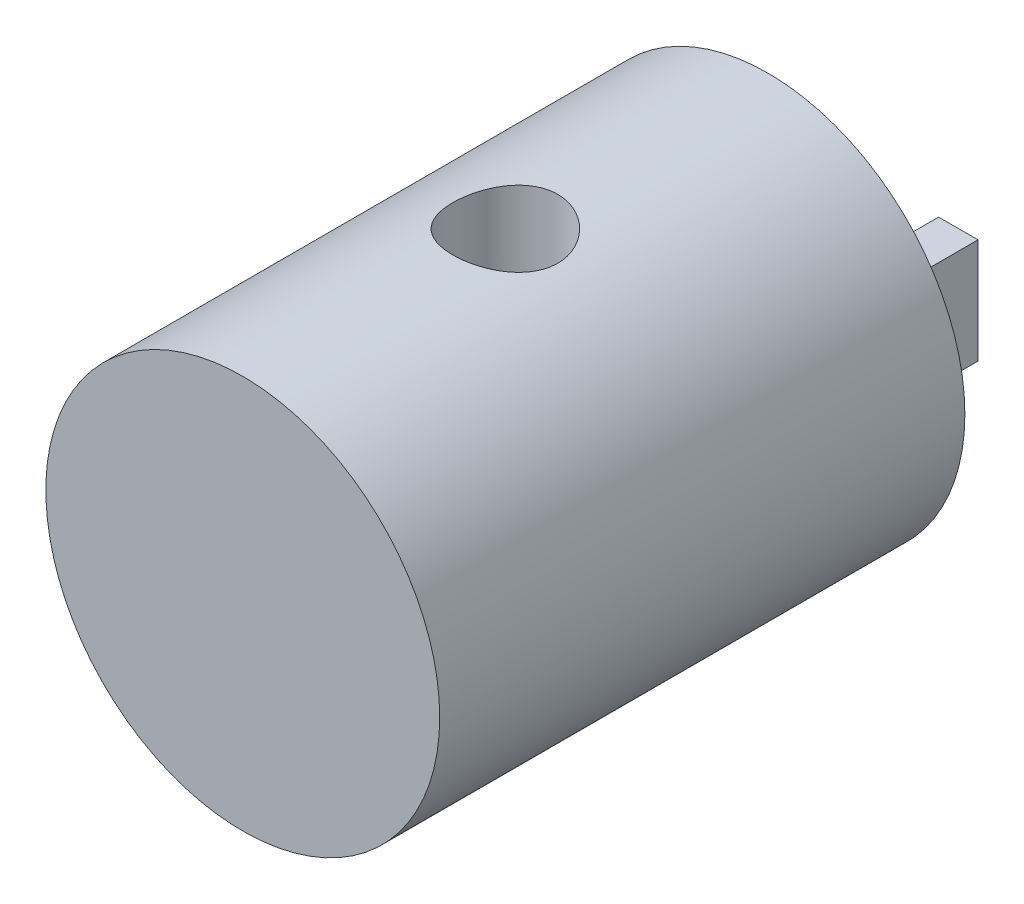
from build123d import *

# Parameters (mm, degrees)
CROQUIS1_R                             = 7.5
SALIENTE_EXTRUIR1_DEPTH                = 20
CROQUIS2_W                             = 5
CROQUIS2_H                             = 4
SALIENTE_EXTRUIR2_DEPTH                = 4
CROQUIS4_W                             = 8
CROQUIS4_H                             = 4
SALIENTE_EXTRUIR4_DEPTH                = 4
CORTAR_EXTRUIR1_REACH                  = 28.879
CROQUIS6_W                             = 5
CROQUIS6_H                             = 4
CROQUIS6_W_2                           = 2.5
CROQUIS7_R                             = 1
CORTAR_EXTRUIR2_DEPTH                  = 5
CORTAR_EXTRUIR3_REACH                  = 28.879
CORTAR_EXTRUIR3_END_RADIUS             = 7.5
CROQUIS8_R                             = 2
CORTAR_EXTRUIR3_DIRECTION_2_REACH      = 28.879
CORTAR_EXTRUIR3_DIRECTION_2_END_RADIUS = 7.5
CROQUIS9_W                             = 4
CROQUIS9_H                             = 4
CORTAR_EXTRUIR4_DEPTH                  = 5


with BuildPart() as part:
    # Croquis1 → Saliente-Extruir1 (new body)
    with BuildSketch(Plane.XY):
        Circle(CROQUIS1_R)
    extrude(amount=SALIENTE_EXTRUIR1_DEPTH)

    # Croquis2 → Saliente-Extruir2 (add)
    with BuildSketch(Plane.XY.offset(20)):
        Rectangle(CROQUIS2_W, CROQUIS2_H)
    extrude(amount=SALIENTE_EXTRUIR2_DEPTH)

    # Croquis4 → Saliente-Extruir4 (add)
    with BuildSketch(Plane(origin=(0, 0, 0), x_dir=(-1, 0, 0), z_dir=(0, 0, -1))):
        Rectangle(CROQUIS4_W, CROQUIS4_H)
    extrude(amount=SALIENTE_EXTRUIR4_DEPTH)

    # Croquis6 → Cortar-Extruir1 (cut, up to next)
    with BuildSketch(Plane(origin=(0, 2, 0), x_dir=(1, 0, 0), z_dir=(0, 1, 0)), mode=Mode.PRIVATE) as cortar_extruir1_sk1:
        with Locations((0, 2)):
            Rectangle(CROQUIS6_W, CROQUIS6_H)
    cortar_extruir1_tool1 = extrude(cortar_extruir1_sk1.sketch, amount=-CORTAR_EXTRUIR1_REACH, mode=Mode.PRIVATE) & part.part
    # Croquis6 → Cortar-Extruir1 (cut, up to next)
    with BuildSketch(Plane(origin=(0, 2, 0), x_dir=(1, 0, 0), z_dir=(0, 1, 0)), mode=Mode.PRIVATE) as cortar_extruir1_sk2:
        with Locations((0, -22)):
            Rectangle(CROQUIS6_W_2, CROQUIS6_H)
    cortar_extruir1_tool2 = extrude(cortar_extruir1_sk2.sketch, amount=-CORTAR_EXTRUIR1_REACH, mode=Mode.PRIVATE) & part.part
    add(cortar_extruir1_tool1.solids().sort_by_distance((0, 2, -2))[0], mode=Mode.SUBTRACT)
    add(cortar_extruir1_tool2.solids().sort_by_distance((0, 2, 22))[0], mode=Mode.SUBTRACT)

    # Croquis7 → Cortar-Extruir2 (cut)
    with BuildSketch(Plane.ZY.offset(4)):
        with Locations((-2.5, 0)):
            Circle(CROQUIS7_R)
        with Locations((22.5, 0)):
            Circle(CROQUIS7_R)
    extrude(amount=-CORTAR_EXTRUIR2_DEPTH, mode=Mode.SUBTRACT)

    # Cortar-Extruir3: up to this cylinder (the profile starts inside it)
    cortar_extruir3_end = Plane(origin=(0, 0, 10), z_dir=(0, 0, -1)) * Cylinder(CORTAR_EXTRUIR3_END_RADIUS, 73.758, mode=Mode.PRIVATE)
    # Croquis8 → Cortar-Extruir3 (cut, up to the surface)
    with BuildSketch(Plane(origin=(0, 2, 0), x_dir=(1, 0, 0), z_dir=(0, 1, 0)), mode=Mode.PRIVATE) as cortar_extruir3_sk1:
        with Locations(Location((0, -10, 0), (0, 0, 90))):
            Circle(CROQUIS8_R)
    cortar_extruir3_tool1 = extrude(cortar_extruir3_sk1.sketch, amount=-CORTAR_EXTRUIR3_REACH, mode=Mode.PRIVATE) & cortar_extruir3_end
    add(cortar_extruir3_tool1.solids().sort_by_distance((0, 2, 10))[0], mode=Mode.SUBTRACT)

    # Cortar-Extruir3 direction 2: up to this cylinder (the profile starts inside it)
    cortar_extruir3_direction_2_end = Plane(origin=(0, 0, 10), z_dir=(0, 0, -1)) * Cylinder(CORTAR_EXTRUIR3_DIRECTION_2_END_RADIUS, 73.758, mode=Mode.PRIVATE)
    # Croquis8 → Cortar-Extruir3 direction 2 (cut, up to the surface)
    with BuildSketch(Plane(origin=(0, 2, 0), x_dir=(1, 0, 0), z_dir=(0, 1, 0)), mode=Mode.PRIVATE) as cortar_extruir3_direction_2_sk1:
        with Locations(Location((0, -10, 0), (0, 0, 90))):
            Circle(CROQUIS8_R)
    cortar_extruir3_direction_2_tool1 = extrude(cortar_extruir3_direction_2_sk1.sketch, amount=CORTAR_EXTRUIR3_DIRECTION_2_REACH, mode=Mode.PRIVATE) & cortar_extruir3_direction_2_end
    add(cortar_extruir3_direction_2_tool1.solids().sort_by_distance((0, 2, 10))[0], mode=Mode.SUBTRACT)

    # Croquis9 → Cortar-Extruir4 (cut)
    with BuildSketch(Plane(origin=(2.5, 0, 0), x_dir=(0, 0, -1), z_dir=(1, 0, 0))):
        with Locations((-22, 0)):
            Rectangle(CROQUIS9_W, CROQUIS9_H)
    extrude(amount=-CORTAR_EXTRUIR4_DEPTH, mode=Mode.SUBTRACT)


solid = part.part
